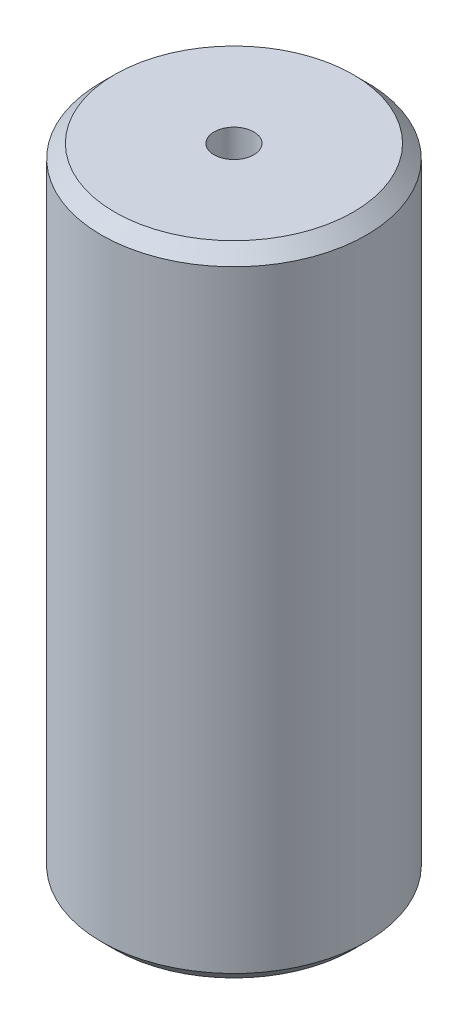
from build123d import *

# Parameters (mm, degrees)
SKETCH1_R           = 10
SKETCH1_R_2         = 1.5
BOSS_EXTRUDE1_DEPTH = 48.2
CHAMFER1_SIZE       = 1


with BuildPart() as part:
    # Sketch1 → Boss-Extrude1 (new body)
    with BuildSketch(Plane(origin=(0, 0, 0), x_dir=(1, 0, 0), z_dir=(0, 1, 0))):
        with Locations(Location((0, 0, 0), (0, 0, 270))):
            Circle(SKETCH1_R)
        with Locations(Location((0, 0, 0), (0, 0, 270))):
            Circle(SKETCH1_R_2, mode=Mode.SUBTRACT)
    extrude(amount=BOSS_EXTRUDE1_DEPTH)

    # Chamfer1
    chamfer1_edges = [part.edges().sort_by_distance(p)[0] for p in [
        (0, 0, -10),
        (0, 48.2, -10),
    ]]
    chamfer(chamfer1_edges, length=CHAMFER1_SIZE)


solid = part.part
